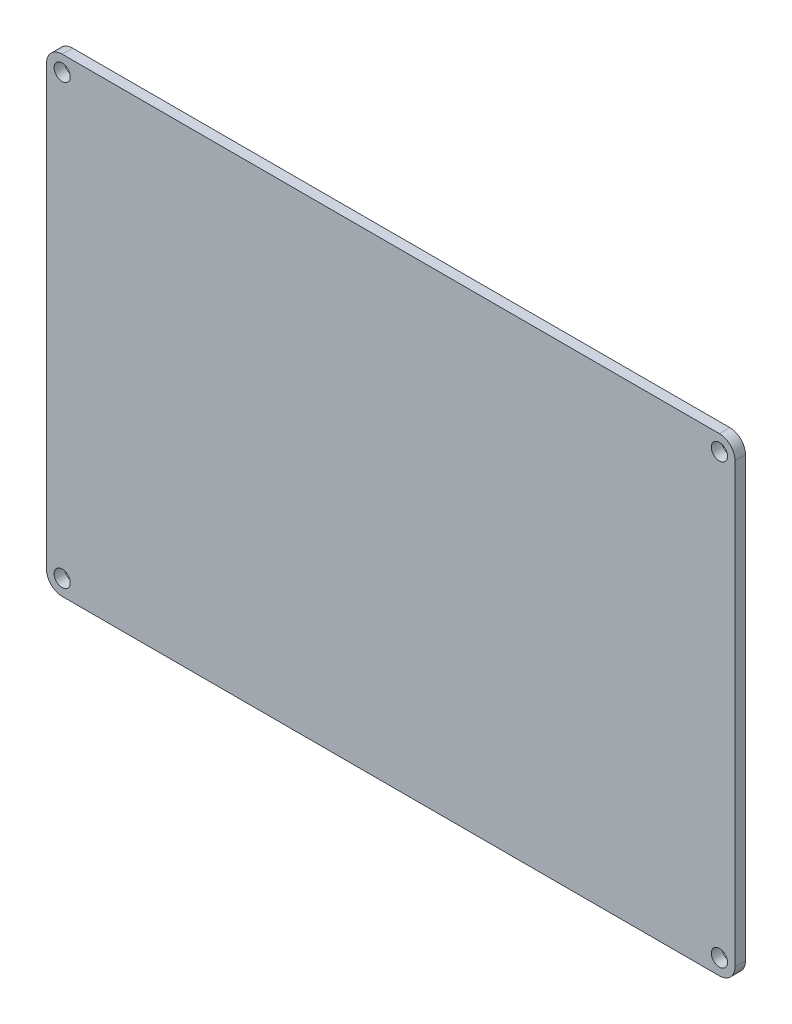
from build123d import *

# Parameters (mm, degrees)
SKETCH1_R           = 1.55
BOSS_EXTRUDE1_DEPTH = 2


with BuildPart() as part:
    # Sketch1 → Boss-Extrude1 (new body)
    with BuildSketch(Plane.XY):
        with BuildLine():
            Line((-62.979304314, -45), (62.979304314, -45))
            ThreePointArc((62.979304314, -45), (65.100624658, -44.121320344), (65.979304314, -42))
            Line((65.979304314, -42), (65.979304314, 42))
            ThreePointArc((65.979304314, 42), (65.100624658, 44.121320344), (62.979304314, 45))
            Line((62.979304314, 45), (-62.979304314, 45))
            ThreePointArc((-62.979304314, 45), (-65.100624658, 44.121320344), (-65.979304314, 42))
            Line((-65.979304314, 42), (-65.979304314, -42))
            ThreePointArc((-65.979304314, -42), (-65.100624658, -44.121320344), (-62.979304314, -45))
        make_face()
        with Locations((-62.979304314, 42)):
            Circle(SKETCH1_R, mode=Mode.SUBTRACT)
        with Locations((-62.979304314, -42)):
            Circle(SKETCH1_R, mode=Mode.SUBTRACT)
        with Locations((62.979304314, -42)):
            Circle(SKETCH1_R, mode=Mode.SUBTRACT)
        with Locations((62.979304314, 42)):
            Circle(SKETCH1_R, mode=Mode.SUBTRACT)
    extrude(amount=BOSS_EXTRUDE1_DEPTH)


solid = part.part
